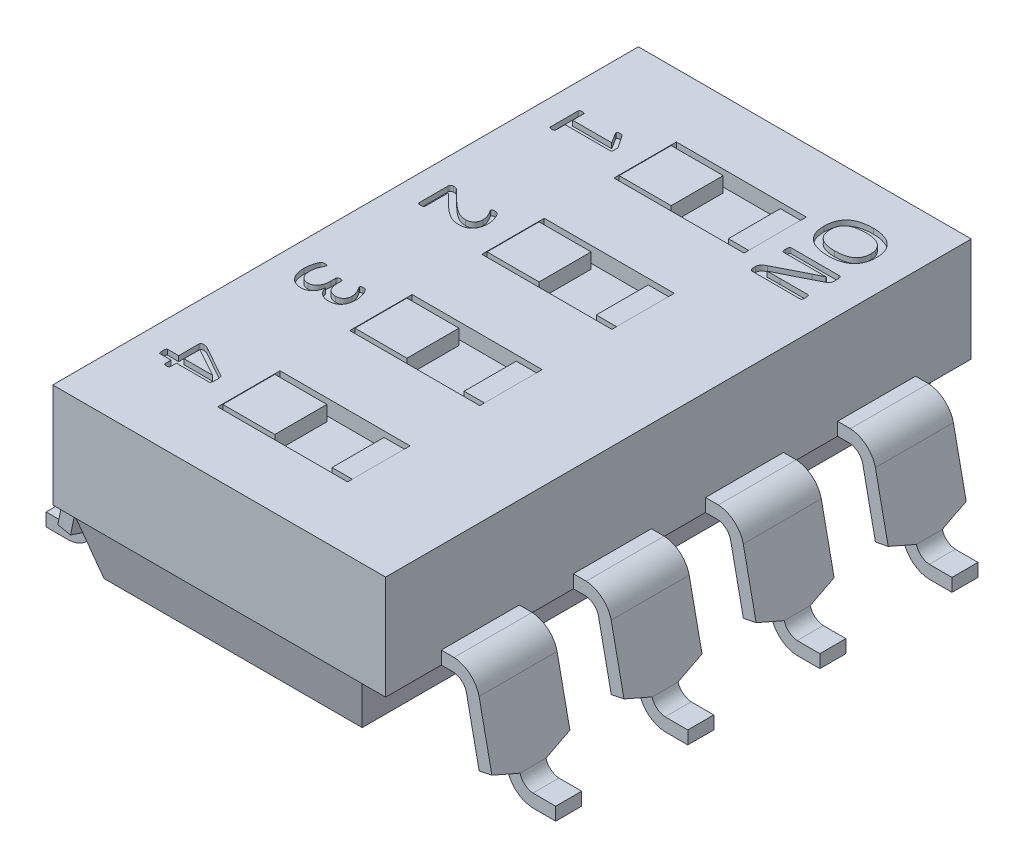
from build123d import *

# Parameters (mm, degrees)
SKETCH1_W                 = 6.4
SKETCH1_H                 = 2
BOSS_EXTRUDE1_DEPTH       = 11.26
SKETCH3_W                 = 5.5
SKETCH3_H                 = 11.26
BOSS_EXTRUDE2_DEPTH       = 1
BOSS_EXTRUDE2_TAPER       = 15
BOSS_EXTRUDE3_DEPTH       = 1.5
CUT_EXTRUDE1_DEPTH        = 14.463996838
SKETCH6_W                 = 1.075878149
SKETCH6_H                 = 0.544890631
SKETCH6_H_2               = 0.541853054
CUT_EXTRUDE2_DEPTH        = 14.633928031
LPATTERN1_COUNT           = 4
LPATTERN1_PITCH           = 2.54
MIRROR1_COPY_1_DEPTH      = 1.5
MIRROR1_COPY_2_DEPTH      = 1.5
MIRROR1_COPY_3_DEPTH      = 1.5
MIRROR1_COPY_4_DEPTH      = 14.463996838
MIRROR1_COPY_5_DEPTH      = 14.463996838
MIRROR1_COPY_6_DEPTH      = 14.463996838
MIRROR1_COPY_7_SKETCH_W   = 1.075878149
MIRROR1_COPY_7_SKETCH_H   = 0.544890631
MIRROR1_COPY_7_SKETCH_H_2 = 0.541853054
MIRROR1_COPY_7_DEPTH      = 14.633928031
MIRROR1_COPY_8_SKETCH_W   = 1.075878149
MIRROR1_COPY_8_SKETCH_H   = 0.544890631
MIRROR1_COPY_8_SKETCH_H_2 = 0.541853054
MIRROR1_COPY_8_DEPTH      = 14.633928031
MIRROR1_COPY_9_SKETCH_W   = 1.075878149
MIRROR1_COPY_9_SKETCH_H   = 0.544890631
MIRROR1_COPY_9_SKETCH_H_2 = 0.541853054
MIRROR1_COPY_9_DEPTH      = 14.633928031
SKETCH7_W                 = 2.5
SKETCH7_H                 = 1.2
CUT_EXTRUDE3_DEPTH        = 0.5
SKETCH8_W                 = 2.5
SKETCH8_H                 = 1.2
BOSS_EXTRUDE4_DEPTH       = 0.2
SKETCH9_W                 = 1
SKETCH9_H                 = 1
SKETCH9_W_2               = 0.4
BOSS_EXTRUDE5_DEPTH       = 0.29
LPATTERN2_COUNT           = 4
LPATTERN2_PITCH           = 2.54
CUT_EXTRUDE_1_DEPTH       = 0.1


with BuildPart() as part:
    # Sketch1 → Boss-Extrude1 (new body)
    with BuildSketch(Plane.XY):
        with Locations((3.2, 1)):
            Rectangle(SKETCH1_W, SKETCH1_H)
    extrude(amount=BOSS_EXTRUDE1_DEPTH)

    # Sketch3 → Boss-Extrude2 (add)
    with BuildSketch(Plane.XZ):
        with Locations((3.2, 5.63)):
            Rectangle(SKETCH3_W, SKETCH3_H)
    extrude(amount=BOSS_EXTRUDE2_DEPTH, taper=BOSS_EXTRUDE2_TAPER)

    # Sketch4 → Boss-Extrude3 (add)
    with BuildSketch(Plane.XY.offset(10.19)):
        with BuildLine():
            Line((0, 0.25), (-0.246171761, 0.25))
            ThreePointArc((-0.246171761, 0.25), (-0.554195762, 0.125012352), (-0.72701005, -0.158952292))
            Line((-0.72701005, -0.158952292), (-1.01402555, -1.543536682))
            ThreePointArc((-1.01402555, -1.543536682), (-1.106345513, -1.685456773), (-1.26286535, -1.75))
            Line((-1.26286535, -1.75), (-1.7, -1.75))
            Line((-1.7, -1.75), (-1.7, -2))
            Line((-1.7, -2), (-1.253405123, -2))
            ThreePointArc((-1.253405123, -2), (-0.947758808, -1.878721464), (-0.770747325, -1.601602197))
            Line((-0.770747325, -1.601602197), (-0.482890076, -0.212957144))
            ThreePointArc((-0.482890076, -0.212957144), (-0.393953766, -0.066905047), (-0.236586053, 0))
            Line((-0.236586053, 0), (0, 0))
            Line((0, 0), (0, 0.25))
        make_face()
    boss_extrude3 = extrude(amount=-BOSS_EXTRUDE3_DEPTH)

    # Sketch5 → Cut-Extrude1 (cut, through all)
    with BuildSketch(Plane(origin=(-0.665464806, 0.137946603, 0), x_dir=(0, 0, 1), z_dir=(-0.9791832101750784, 0.20297842474319372, 0))):
        Polygon((9.69, -1.717230512), (10.19, -1.517230512), (10.19, -1.717230512), align=None)
        Polygon((8.69, -1.717230512), (8.69, -1.517230512), (9.19, -1.717230512), align=None)
    cut_extrude1 = extrude(amount=-CUT_EXTRUDE1_DEPTH, mode=Mode.SUBTRACT)

    # Sketch6 → Cut-Extrude2 (cut, through all)
    with BuildSketch(Plane(origin=(-0.348560744, -1.681483286, 0), x_dir=(0.9791832101750784, -0.20297842474319375, 0), z_dir=(0.20297842474319375, 0.9791832101750784, 0))):
        with Locations((-0.967551224, -9.962445316)):
            Rectangle(SKETCH6_W, SKETCH6_H)
        with Locations((-0.967551224, -8.919073473)):
            Rectangle(SKETCH6_W, SKETCH6_H_2)
    cut_extrude2 = extrude(amount=-CUT_EXTRUDE2_DEPTH, mode=Mode.SUBTRACT)

    # LPattern1: Boss-Extrude3, Cut-Extrude1, Cut-Extrude2 ×4
    with Locations(*[(0, 0, -i * LPATTERN1_PITCH) for i in range(1, LPATTERN1_COUNT)]):
        add(boss_extrude3)
        add(cut_extrude1, mode=Mode.SUBTRACT)
        add(cut_extrude2, mode=Mode.SUBTRACT)

    # Mirror1: Boss-Extrude3, Cut-Extrude1, Cut-Extrude2 across plane
    add(boss_extrude3.mirror(Plane.ZY.offset(-3.2)))
    add(cut_extrude1.mirror(Plane.ZY.offset(-3.2)), mode=Mode.SUBTRACT)
    add(cut_extrude2.mirror(Plane.ZY.offset(-3.2)), mode=Mode.SUBTRACT)

    # Mirror1 copy 1 sketch → Mirror1 copy 1 (add)
    with BuildSketch(Plane(origin=(6.4, 0, 7.65), x_dir=(-1, 0, 0), z_dir=(0, 0, 1))):
        with BuildLine():
            Line((0, -0.25), (-0.246171761, -0.25))
            ThreePointArc((-0.246171761, -0.25), (-0.554195762, -0.125012352), (-0.72701005, 0.158952292))
            Line((-0.72701005, 0.158952292), (-1.01402555, 1.543536682))
            ThreePointArc((-1.01402555, 1.543536682), (-1.106345513, 1.685456773), (-1.26286535, 1.75))
            Line((-1.26286535, 1.75), (-1.7, 1.75))
            Line((-1.7, 1.75), (-1.7, 2))
            Line((-1.7, 2), (-1.253405123, 2))
            ThreePointArc((-1.253405123, 2), (-0.947758808, 1.878721464), (-0.770747325, 1.601602197))
            Line((-0.770747325, 1.601602197), (-0.482890076, 0.212957144))
            ThreePointArc((-0.482890076, 0.212957144), (-0.393953766, 0.066905047), (-0.236586053, 0))
            Line((-0.236586053, 0), (0, 0))
            Line((0, 0), (0, -0.25))
        make_face()
    extrude(amount=-MIRROR1_COPY_1_DEPTH)

    # Mirror1 copy 2 sketch → Mirror1 copy 2 (add)
    with BuildSketch(Plane(origin=(6.4, 0, 5.11), x_dir=(-1, 0, 0), z_dir=(0, 0, 1))):
        with BuildLine():
            Line((0, -0.25), (-0.246171761, -0.25))
            ThreePointArc((-0.246171761, -0.25), (-0.554195762, -0.125012352), (-0.72701005, 0.158952292))
            Line((-0.72701005, 0.158952292), (-1.01402555, 1.543536682))
            ThreePointArc((-1.01402555, 1.543536682), (-1.106345513, 1.685456773), (-1.26286535, 1.75))
            Line((-1.26286535, 1.75), (-1.7, 1.75))
            Line((-1.7, 1.75), (-1.7, 2))
            Line((-1.7, 2), (-1.253405123, 2))
            ThreePointArc((-1.253405123, 2), (-0.947758808, 1.878721464), (-0.770747325, 1.601602197))
            Line((-0.770747325, 1.601602197), (-0.482890076, 0.212957144))
            ThreePointArc((-0.482890076, 0.212957144), (-0.393953766, 0.066905047), (-0.236586053, 0))
            Line((-0.236586053, 0), (0, 0))
            Line((0, 0), (0, -0.25))
        make_face()
    extrude(amount=-MIRROR1_COPY_2_DEPTH)

    # Mirror1 copy 3 sketch → Mirror1 copy 3 (add)
    with BuildSketch(Plane(origin=(6.4, 0, 2.57), x_dir=(-1, 0, 0), z_dir=(0, 0, 1))):
        with BuildLine():
            Line((0, -0.25), (-0.246171761, -0.25))
            ThreePointArc((-0.246171761, -0.25), (-0.554195762, -0.125012352), (-0.72701005, 0.158952292))
            Line((-0.72701005, 0.158952292), (-1.01402555, 1.543536682))
            ThreePointArc((-1.01402555, 1.543536682), (-1.106345513, 1.685456773), (-1.26286535, 1.75))
            Line((-1.26286535, 1.75), (-1.7, 1.75))
            Line((-1.7, 1.75), (-1.7, 2))
            Line((-1.7, 2), (-1.253405123, 2))
            ThreePointArc((-1.253405123, 2), (-0.947758808, 1.878721464), (-0.770747325, 1.601602197))
            Line((-0.770747325, 1.601602197), (-0.482890076, 0.212957144))
            ThreePointArc((-0.482890076, 0.212957144), (-0.393953766, 0.066905047), (-0.236586053, 0))
            Line((-0.236586053, 0), (0, 0))
            Line((0, 0), (0, -0.25))
        make_face()
    extrude(amount=-MIRROR1_COPY_3_DEPTH)

    # Mirror1 copy 4 sketch → Mirror1 copy 4 (cut, through all)
    with BuildSketch(Plane(origin=(7.065464806, 0.137946603, -2.54), x_dir=(0, 0, 1), z_dir=(0.9791832101750784, 0.20297842474319372, 0))):
        Polygon((9.69, 1.717230512), (10.19, 1.517230512), (10.19, 1.717230512), align=None)
        Polygon((8.69, 1.717230512), (8.69, 1.517230512), (9.19, 1.717230512), align=None)
    extrude(amount=-MIRROR1_COPY_4_DEPTH, mode=Mode.SUBTRACT)

    # Mirror1 copy 5 sketch → Mirror1 copy 5 (cut, through all)
    with BuildSketch(Plane(origin=(7.065464806, 0.137946603, -5.08), x_dir=(0, 0, 1), z_dir=(0.9791832101750784, 0.20297842474319372, 0))):
        Polygon((9.69, 1.717230512), (10.19, 1.517230512), (10.19, 1.717230512), align=None)
        Polygon((8.69, 1.717230512), (8.69, 1.517230512), (9.19, 1.717230512), align=None)
    extrude(amount=-MIRROR1_COPY_5_DEPTH, mode=Mode.SUBTRACT)

    # Mirror1 copy 6 sketch → Mirror1 copy 6 (cut, through all)
    with BuildSketch(Plane(origin=(7.065464806, 0.137946603, -7.62), x_dir=(0, 0, 1), z_dir=(0.9791832101750784, 0.20297842474319372, 0))):
        Polygon((9.69, 1.717230512), (10.19, 1.517230512), (10.19, 1.717230512), align=None)
        Polygon((8.69, 1.717230512), (8.69, 1.517230512), (9.19, 1.717230512), align=None)
    extrude(amount=-MIRROR1_COPY_6_DEPTH, mode=Mode.SUBTRACT)

    # Mirror1 copy 7 sketch → Mirror1 copy 7 (cut, through all)
    with BuildSketch(Plane(origin=(6.748560744, -1.681483286, -2.54), x_dir=(-0.9791832101750784, -0.20297842474319375, 0), z_dir=(-0.20297842474319375, 0.9791832101750784, 0))):
        with Locations((-0.967551224, 9.962445316)):
            Rectangle(MIRROR1_COPY_7_SKETCH_W, MIRROR1_COPY_7_SKETCH_H)
        with Locations((-0.967551224, 8.919073473)):
            Rectangle(MIRROR1_COPY_7_SKETCH_W, MIRROR1_COPY_7_SKETCH_H_2)
    extrude(amount=-MIRROR1_COPY_7_DEPTH, mode=Mode.SUBTRACT)

    # Mirror1 copy 8 sketch → Mirror1 copy 8 (cut, through all)
    with BuildSketch(Plane(origin=(6.748560744, -1.681483286, -5.08), x_dir=(-0.9791832101750784, -0.20297842474319375, 0), z_dir=(-0.20297842474319375, 0.9791832101750784, 0))):
        with Locations((-0.967551224, 9.962445316)):
            Rectangle(MIRROR1_COPY_8_SKETCH_W, MIRROR1_COPY_8_SKETCH_H)
        with Locations((-0.967551224, 8.919073473)):
            Rectangle(MIRROR1_COPY_8_SKETCH_W, MIRROR1_COPY_8_SKETCH_H_2)
    extrude(amount=-MIRROR1_COPY_8_DEPTH, mode=Mode.SUBTRACT)

    # Mirror1 copy 9 sketch → Mirror1 copy 9 (cut, through all)
    with BuildSketch(Plane(origin=(6.748560744, -1.681483286, -7.62), x_dir=(-0.9791832101750784, -0.20297842474319375, 0), z_dir=(-0.20297842474319375, 0.9791832101750784, 0))):
        with Locations((-0.967551224, 9.962445316)):
            Rectangle(MIRROR1_COPY_9_SKETCH_W, MIRROR1_COPY_9_SKETCH_H)
        with Locations((-0.967551224, 8.919073473)):
            Rectangle(MIRROR1_COPY_9_SKETCH_W, MIRROR1_COPY_9_SKETCH_H_2)
    extrude(amount=-MIRROR1_COPY_9_DEPTH, mode=Mode.SUBTRACT)

    # Sketch7 → Cut-Extrude3 (cut)
    with BuildSketch(Plane(origin=(0, 2, 0), x_dir=(1, 0, 0), z_dir=(0, 1, 0))):
        with Locations((3.2, -4.36)):
            Rectangle(SKETCH7_W, SKETCH7_H)
        with Locations((3.2, -1.82)):
            Rectangle(SKETCH7_W, SKETCH7_H)
        with Locations((3.2, -6.9)):
            Rectangle(SKETCH7_W, SKETCH7_H)
        with Locations((3.2, -9.44)):
            Rectangle(SKETCH7_W, SKETCH7_H)
    extrude(amount=-CUT_EXTRUDE3_DEPTH, mode=Mode.SUBTRACT)

    # Sketch8 → Boss-Extrude4 (add)
    with BuildSketch(Plane(origin=(0, 1.5, 0), x_dir=(1, 0, 0), z_dir=(0, 1, 0))):
        with Locations((3.2, -1.82)):
            Rectangle(SKETCH8_W, SKETCH8_H)
    boss_extrude4 = extrude(amount=BOSS_EXTRUDE4_DEPTH)

    # Sketch9 → Boss-Extrude5 (add)
    with BuildSketch(Plane(origin=(0, 1.7, 0), x_dir=(1, 0, 0), z_dir=(0, 1, 0))):
        with Locations((2.45, -1.82)):
            Rectangle(SKETCH9_W, SKETCH9_H)
        with Locations((4.25, -1.82)):
            Rectangle(SKETCH9_W_2, SKETCH9_H)
    boss_extrude5 = extrude(amount=BOSS_EXTRUDE5_DEPTH)

    # LPattern2: Boss-Extrude4, Boss-Extrude5 ×4
    with Locations(*[(0, 0, i * LPATTERN2_PITCH) for i in range(1, LPATTERN2_COUNT)]):
        add(boss_extrude4)
        add(boss_extrude5)

    # Sketch10 → Вырез-Вытянуть1 (cut)
    # profile 1 of 6: a face of its own
    with BuildSketch(Plane(origin=(0, 2, 0), x_dir=(1, 0, 0), z_dir=(0, 1, 0))):
        with BuildLine():
            add(Edge.make_bspline(
                [(5.296111026, -1.658169902), (5.276415082, -1.65780976), (5.237869423, -1.657104948), (5.181572343, -1.651818383), (5.128175235, -1.642908135), (5.077914447, -1.630325924), (5.030822162, -1.61438402), (4.987412598, -1.594564993), (4.947619433, -1.5712187), (4.911264448, -1.544588722), (4.878874772, -1.514014249), (4.850437961, -1.479859672), (4.826212439, -1.441937152), (4.805597463, -1.400677098), (4.789494429, -1.355554195), (4.778158021, -1.306836801), (4.771123985, -1.254575775), (4.770326816, -1.218548393), (4.769916173, -1.199989755)],
                knots=[0, 0, 0, 0, 1.191349841, 2.33151377, 3.416966321, 4.463182302, 5.462485, 6.420369482, 7.344547342, 8.24900213, 9.140535385, 10.032176993, 10.930546801, 11.856778172, 12.816733517, 13.821446026, 14.877770412, 16, 16, 16, 16], degree=3))
            add(Edge.make_bspline(
                [(4.769916173, -1.199989755), (4.77025943, -1.181738427), (4.770925173, -1.146340132), (4.777563717, -1.095296376), (4.787668937, -1.04794648), (4.80240302, -1.004444924), (4.821437516, -0.964706156), (4.84385202, -0.928293187), (4.870656264, -0.895906407), (4.900970806, -0.866884179), (4.935291276, -0.8415093), (4.973376217, -0.81961191), (5.015398876, -0.801521457), (5.06106516, -0.786547071), (5.110557836, -0.775266333), (5.163613879, -0.767076203), (5.220181522, -0.761907945), (5.259105033, -0.761381574), (5.27910735, -0.761111079)],
                knots=[0, 0, 0, 0, 1.137667702, 2.206496874, 3.204370452, 4.15299996, 5.06318426, 5.947235594, 6.812662801, 7.677575739, 8.558407935, 9.46786496, 10.411212271, 11.406659154, 12.461056006, 13.573073946, 14.752832389, 16, 16, 16, 16], degree=3))
            add(Edge.make_bspline(
                [(5.27910735, -0.761111079), (5.298421286, -0.761465208), (5.336128163, -0.762156579), (5.391344906, -0.76751966), (5.44383741, -0.776353053), (5.493530309, -0.789040053), (5.540212384, -0.804841193), (5.583314893, -0.824763248), (5.62277562, -0.848219346), (5.658624933, -0.875246858), (5.690861439, -0.905707392), (5.719069533, -0.93999897), (5.743317796, -0.9779736), (5.7635412, -1.019536972), (5.779735038, -1.064565806), (5.791135402, -1.113279288), (5.798101069, -1.165550401), (5.798911396, -1.201652397), (5.799327938, -1.220210343)],
                knots=[0, 0, 0, 0, 1.175343485, 2.294640089, 3.372947809, 4.412007972, 5.413017894, 6.368293769, 7.296489874, 8.201798854, 9.095401933, 9.989527717, 10.897317773, 11.831337077, 12.797167058, 13.803492583, 14.870902707, 16, 16, 16, 16], degree=3))
            add(Edge.make_bspline(
                [(5.799327938, -1.220210343), (5.798947315, -1.238073742), (5.798208119, -1.272765685), (5.792039602, -1.323045387), (5.781419467, -1.369731096), (5.767042018, -1.412926795), (5.74857092, -1.452585905), (5.726082152, -1.488734289), (5.699852065, -1.521601601), (5.669437808, -1.550708613), (5.635339459, -1.576308392), (5.597700277, -1.598808906), (5.556036865, -1.617296774), (5.510787266, -1.632451034), (5.461942971, -1.644090834), (5.409684611, -1.65215143), (5.35404565, -1.657393295), (5.315808017, -1.657905866), (5.296111026, -1.658169902)],
                knots=[0, 0, 0, 0, 1.124153723, 2.183183562, 3.18197749, 4.133311137, 5.04347791, 5.929104716, 6.80702139, 7.683308329, 8.57135945, 9.485819096, 10.43743367, 11.434504052, 12.485735786, 13.593802196, 14.76051808, 16, 16, 16, 16], degree=3))
        make_face()
        with BuildLine():
            add(Edge.make_bspline(
                [(5.286230512, -1.511111079), (5.300021735, -1.510938698), (5.327172843, -1.510599327), (5.367130944, -1.507801633), (5.40562373, -1.50319098), (5.442529843, -1.496976483), (5.477494537, -1.488259734), (5.510310372, -1.477298636), (5.540752463, -1.463756745), (5.56879887, -1.447628613), (5.594216822, -1.428786426), (5.616787665, -1.406994883), (5.636141518, -1.38218005), (5.652674757, -1.354549989), (5.665881183, -1.323685601), (5.67520297, -1.28944835), (5.680737313, -1.25179385), (5.681357642, -1.225591575), (5.681680879, -1.211938284)],
                knots=[0, 0, 0, 0, 1.16906547, 2.301566814, 3.393680675, 4.454778471, 5.47212095, 6.44540886, 7.384232912, 8.291912384, 9.18278391, 10.059847445, 10.943138162, 11.842909913, 12.782474672, 13.779662713, 14.843042763, 16, 16, 16, 16], degree=3))
            add(Edge.make_bspline(
                [(5.681680879, -1.211938284), (5.681299923, -1.198281423), (5.680568264, -1.172052283), (5.674554753, -1.134365787), (5.664533655, -1.100096878), (5.650345542, -1.069154747), (5.632654162, -1.041551867), (5.612526734, -1.016371337), (5.589524171, -0.994052302), (5.563737363, -0.974730082), (5.535742015, -0.957811964), (5.505381389, -0.943622797), (5.472728943, -0.932093727), (5.4380546, -0.923367592), (5.401907379, -0.916486743), (5.364604579, -0.911782413), (5.326420155, -0.908618046), (5.300636546, -0.908320327), (5.287609188, -0.908169902)],
                knots=[0, 0, 0, 0, 1.161227874, 2.230234876, 3.23623063, 4.189578402, 5.115044591, 6.018624442, 6.926329179, 7.833285333, 8.754014825, 9.704195839, 10.678922322, 11.695036858, 12.742866953, 13.807197742, 14.89207049, 16, 16, 16, 16], degree=3))
            add(Edge.make_bspline(
                [(5.287609188, -0.908169902), (5.273357585, -0.908333329), (5.245363122, -0.90865435), (5.20427868, -0.911560182), (5.164826613, -0.915753289), (5.127279824, -0.922121394), (5.091777988, -0.930584673), (5.058542725, -0.941133119), (5.028050266, -0.954942072), (4.999885098, -0.970681929), (4.974282243, -0.989021901), (4.952023076, -1.010768097), (4.932570134, -1.035278306), (4.916153576, -1.062804892), (4.903036029, -1.093664398), (4.894092359, -1.128111288), (4.888479127, -1.166181633), (4.88787745, -1.192768618), (4.887563232, -1.206653358)],
                knots=[0, 0, 0, 0, 1.197112985, 2.35149234, 3.458580793, 4.529125571, 5.548253836, 6.522942298, 7.453293408, 8.355171445, 9.230372149, 10.090421365, 10.960688115, 11.852339373, 12.774981647, 13.767684789, 14.834199703, 16, 16, 16, 16], degree=3))
            add(Edge.make_bspline(
                [(4.887563232, -1.206653358), (4.887948083, -1.220386382), (4.888689487, -1.246842686), (4.894691548, -1.284907231), (4.904709141, -1.319634972), (4.918874034, -1.350958873), (4.936475201, -1.379010661), (4.957226174, -1.403891525), (4.98020336, -1.426526914), (5.006435664, -1.445778393), (5.035097031, -1.462319514), (5.065878953, -1.476332534), (5.09886274, -1.487579954), (5.133688002, -1.496441999), (5.170180307, -1.503037394), (5.207949042, -1.50744946), (5.246729737, -1.510677032), (5.272973006, -1.510965401), (5.286230512, -1.511111079)],
                knots=[0, 0, 0, 0, 1.156376524, 2.227728346, 3.236314579, 4.192133592, 5.114055089, 6.016996904, 6.915872434, 7.824329852, 8.74947427, 9.699417313, 10.668622314, 11.681101484, 12.723901887, 13.789878023, 14.883496378, 16, 16, 16, 16], degree=3))
        make_face(mode=Mode.SUBTRACT)
    # profile 2 of 6: a face of its own
    with BuildSketch(Plane(origin=(0, 2, 0), x_dir=(1, 0, 0), z_dir=(0, 1, 0))):
        with BuildLine():
            add(Edge.make_bspline(
                [(4.84160735, -2.64346402), (4.836819423, -2.643249752), (4.827801797, -2.642846198), (4.815438866, -2.638514108), (4.805405261, -2.631971473), (4.797427081, -2.623724859), (4.791385344, -2.614156891), (4.787291694, -2.603526683), (4.785016497, -2.592398156), (4.784751813, -2.58487963), (4.784622056, -2.581193799)],
                knots=[0, 0, 0, 0, 1.205195523, 2.269876715, 3.262688849, 4.206796125, 5.146133144, 6.101866096, 7.069471963, 8, 8, 8, 8], degree=3))
            Line((4.784622056, -2.581193799), (4.784622056, -2.534318799))
            add(Edge.make_bspline(
                [(4.784622056, -2.534318799), (4.784838811, -2.527338145), (4.78524404, -2.514287613), (4.788349687, -2.495580775), (4.794758579, -2.478686343), (4.804784274, -2.462877466), (4.8188187, -2.447825424), (4.836834074, -2.43274342), (4.85961408, -2.417801409), (4.876899641, -2.408844867), (4.886184556, -2.404033873)],
                knots=[0, 0, 0, 0, 0.949295484, 1.774735033, 2.565947931, 3.389611136, 4.303976894, 5.353577399, 6.578477978, 8, 8, 8, 8], degree=3))
            Line((4.886184556, -2.404033873), (5.452361026, -2.114511814))
            add(Edge.make_bspline(
                [(5.452361026, -2.114511814), (5.467355327, -2.106893188), (5.497863432, -2.091391976), (5.544256333, -2.06866389), (5.590997595, -2.046537914), (5.622368827, -2.032646771), (5.637793012, -2.025816961)],
                knots=[0, 0, 0, 0, 0.981709107, 1.997431203, 3.015403985, 4, 4, 4, 4], degree=3))
            Line((5.637793012, -2.025816961), (5.637793012, -2.024208505))
            add(Edge.make_bspline(
                [(5.637793012, -2.024208505), (5.619181721, -2.024642749), (5.581503023, -2.025521878), (5.524665347, -2.025896817), (5.467373335, -2.025797057), (5.429153324, -2.025810335), (5.410081615, -2.025816961)],
                knots=[0, 0, 0, 0, 0.98097619, 1.98599371, 2.995014897, 4, 4, 4, 4], degree=3))
            Line((5.410081615, -2.025816961), (4.809208453, -2.025816961))
            add(Edge.make_bspline(
                [(4.809208453, -2.025816961), (4.8074249, -2.02560895), (4.80376218, -2.025181778), (4.798376834, -2.022522689), (4.793909418, -2.017266681), (4.790455866, -2.009579989), (4.78866988, -1.999248972), (4.785992034, -1.986483665), (4.784854783, -1.970302916), (4.784705021, -1.958414099), (4.784622056, -1.95182799)],
                knots=[0, 0, 0, 0, 0.507629026, 1.042471493, 1.658265389, 2.426739807, 3.40789359, 4.62344465, 6.12947268, 8, 8, 8, 8], degree=3))
            add(Edge.make_bspline(
                [(4.784622056, -1.95182799), (4.784701778, -1.945240891), (4.784845687, -1.933350284), (4.786018089, -1.917180279), (4.788554384, -1.904604654), (4.790546702, -1.8946416), (4.793873694, -1.887234585), (4.798521446, -1.882332685), (4.803692199, -1.879338601), (4.807413644, -1.878947001), (4.809208453, -1.878758137)],
                knots=[0, 0, 0, 0, 1.891572084, 3.414544002, 4.643770878, 5.571751689, 6.329019298, 6.93561505, 7.486659786, 8, 8, 8, 8], degree=3))
            Line((4.809208453, -1.878758137), (5.727636762, -1.878758137))
            add(Edge.make_bspline(
                [(5.727636762, -1.878758137), (5.732406701, -1.878954637), (5.741400615, -1.879325145), (5.753925471, -1.882695298), (5.764245041, -1.88880036), (5.771840066, -1.897398466), (5.777431315, -1.907052889), (5.781687993, -1.917152028), (5.784008619, -1.927828751), (5.784414607, -1.935043847), (5.784622056, -1.938730564)],
                knots=[0, 0, 0, 0, 1.222480005, 2.305035548, 3.292617378, 4.252430297, 5.213047754, 6.147369849, 7.053356642, 8, 8, 8, 8], degree=3))
            Line((5.784622056, -1.938730564), (5.784622056, -2.008813284))
            add(Edge.make_bspline(
                [(5.784622056, -2.008813284), (5.784500215, -2.016407484), (5.784276277, -2.030365193), (5.781360452, -2.04963887), (5.776187551, -2.066182331), (5.768213218, -2.08069719), (5.757065417, -2.093974925), (5.742854345, -2.106672613), (5.724768771, -2.118920354), (5.711094347, -2.126214002), (5.703739703, -2.130136814)],
                knots=[0, 0, 0, 0, 1.163684759, 2.138786855, 2.978191552, 3.808674946, 4.659829269, 5.624477827, 6.722350489, 8, 8, 8, 8], degree=3))
            Line((5.703739703, -2.130136814), (5.266929041, -2.352333505))
            add(Edge.make_bspline(
                [(5.266929041, -2.352333505), (5.253749233, -2.358985509), (5.227695407, -2.372135181), (5.189173753, -2.391829856), (5.151129341, -2.41033374), (5.113927296, -2.428531387), (5.077281265, -2.446230287), (5.041152651, -2.463741465), (5.005209309, -2.481092318), (4.981170654, -2.492368078), (4.969134923, -2.498013652)],
                knots=[0, 0, 0, 0, 1.068742979, 2.112689677, 3.13185519, 4.131205534, 5.110747879, 6.077892953, 7.037634914, 8, 8, 8, 8], degree=3))
            add(Edge.make_bspline(
                [(4.969134923, -2.498013652), (4.989737889, -2.498279915), (5.031783849, -2.497416516), (5.095283211, -2.496869507), (5.158778575, -2.496294428), (5.200829029, -2.49636877), (5.221432717, -2.496405196)],
                knots=[0, 0, 0, 0, 0.980070645, 2.000100891, 3.020098614, 4, 4, 4, 4], degree=3))
            Line((5.221432717, -2.496405196), (5.760035659, -2.496405196))
            add(Edge.make_bspline(
                [(5.760035659, -2.496405196), (5.761834631, -2.496583895), (5.765497425, -2.496947734), (5.770601647, -2.500062178), (5.775135263, -2.505186114), (5.77863792, -2.512853128), (5.781677205, -2.522866769), (5.783238163, -2.535890704), (5.784406376, -2.552294607), (5.784544705, -2.564492451), (5.784622056, -2.571313284)],
                knots=[0, 0, 0, 0, 0.502953326, 1.024036879, 1.634158783, 2.404945848, 3.372755644, 4.570153255, 6.082086269, 8, 8, 8, 8], degree=3))
            add(Edge.make_bspline(
                [(5.784622056, -2.571313284), (5.784536795, -2.577444882), (5.784377828, -2.588877192), (5.783181617, -2.604584207), (5.781762323, -2.617650327), (5.778506628, -2.627598363), (5.774765373, -2.63496908), (5.770447284, -2.640093271), (5.765267914, -2.642831746), (5.761745441, -2.643257407), (5.760035659, -2.64346402)],
                knots=[0, 0, 0, 0, 1.781386541, 3.321379914, 4.580616967, 5.587268504, 6.344121305, 6.974526363, 7.50224285, 8, 8, 8, 8], degree=3))
            Line((5.760035659, -2.64346402), (4.84160735, -2.64346402))
        make_face()
    # profile 3 of 6: a face of its own
    with BuildSketch(Plane(origin=(0, 2, 0), x_dir=(1, 0, 0), z_dir=(0, 1, 0))):
        with BuildLine():
            add(Edge.make_bspline(
                [(0.539031739, -2.207070391), (0.534666938, -2.206904836), (0.526668423, -2.206601457), (0.515584664, -2.205286138), (0.506836255, -2.202081994), (0.499674121, -2.198815442), (0.494422857, -2.194465336), (0.490534239, -2.189692273), (0.488757265, -2.184204103), (0.488416652, -2.180576968), (0.488250489, -2.178807523)],
                knots=[0, 0, 0, 0, 1.626914997, 2.981328552, 4.126067624, 5.082084556, 5.892289713, 6.644788339, 7.338879749, 8, 8, 8, 8], degree=3))
            Line((0.488250489, -2.178807523), (0.488250489, -1.647097964))
            add(Edge.make_bspline(
                [(0.488250489, -1.647097964), (0.488400353, -1.645324401), (0.488695412, -1.64183253), (0.490606522, -1.636598608), (0.494553854, -1.632097586), (0.499691735, -1.627586065), (0.506659872, -1.623647547), (0.51568227, -1.621044555), (0.526624049, -1.619164105), (0.534655537, -1.618951138), (0.539031739, -1.618835096)],
                knots=[0, 0, 0, 0, 0.664049556, 1.307411016, 2.040676551, 2.872895705, 3.860084643, 5.000950549, 6.365876435, 8, 8, 8, 8], degree=3))
            add(Edge.make_bspline(
                [(0.539031739, -1.618835096), (0.543180581, -1.618851698), (0.550914215, -1.618882643), (0.56157171, -1.620922566), (0.570585204, -1.623261277), (0.577909266, -1.62658394), (0.583836391, -1.630325735), (0.587895613, -1.635200438), (0.590623695, -1.640558158), (0.591002782, -1.644463007), (0.591191665, -1.646408626)],
                knots=[0, 0, 0, 0, 1.529937288, 2.851873351, 3.999151653, 4.962201758, 5.818165368, 6.561341605, 7.283178177, 8, 8, 8, 8], degree=3))
            Line((0.591191665, -1.646408626), (0.591191665, -1.854129214))
            Line((0.591191665, -1.854129214), (1.341191665, -1.854129214))
            Line((1.341191665, -1.854129214), (1.223544607, -1.665020758))
            add(Edge.make_bspline(
                [(1.223544607, -1.665020758), (1.221405138, -1.660695715), (1.217731686, -1.65326965), (1.213734861, -1.643037288), (1.21364391, -1.63431412), (1.217593285, -1.627245559), (1.225226503, -1.622673117), (1.235803536, -1.620218409), (1.249482334, -1.619055628), (1.259694533, -1.618913826), (1.265364459, -1.618835096)],
                knots=[0, 0, 0, 0, 1.299809481, 2.231762388, 2.932755888, 3.56928973, 4.312341354, 5.252235573, 6.474410853, 8, 8, 8, 8], degree=3))
            add(Edge.make_bspline(
                [(1.265364459, -1.618835096), (1.269580709, -1.61884073), (1.277335998, -1.618851092), (1.288064497, -1.61986661), (1.297037685, -1.621044315), (1.304443054, -1.623187564), (1.310659915, -1.625920671), (1.315937489, -1.629872209), (1.32087661, -1.634834737), (1.323781831, -1.638781413), (1.325336886, -1.64089392)],
                knots=[0, 0, 0, 0, 1.503679701, 2.765839883, 3.844451719, 4.726829847, 5.509588363, 6.253183833, 7.064995274, 8, 8, 8, 8], degree=3))
            Line((1.325336886, -1.64089392), (1.478599754, -1.866537302))
            add(Edge.make_bspline(
                [(1.478599754, -1.866537302), (1.479415618, -1.867814395), (1.481161067, -1.870546589), (1.482872968, -1.875514094), (1.484506565, -1.881430692), (1.486088388, -1.888551769), (1.487624746, -1.896961767), (1.487723439, -1.906908925), (1.488431331, -1.918688398), (1.488314912, -1.927273605), (1.488250489, -1.932024435)],
                knots=[0, 0, 0, 0, 0.541270067, 1.157985617, 1.870459843, 2.742627338, 3.771300412, 4.925232739, 6.298504129, 8, 8, 8, 8], degree=3))
            add(Edge.make_bspline(
                [(1.488250489, -1.932024435), (1.488172165, -1.938385286), (1.488029518, -1.949969989), (1.486828111, -1.965601755), (1.48543701, -1.978112551), (1.483034711, -1.987587268), (1.479914076, -1.994482941), (1.475852924, -1.9987535), (1.471253958, -2.000746608), (1.468198887, -2.001039607), (1.466651224, -2.001188038)],
                knots=[0, 0, 0, 0, 1.93989485, 3.533034417, 4.782157296, 5.774019735, 6.505473852, 7.067217241, 7.527463125, 8, 8, 8, 8], degree=3))
            Line((1.466651224, -2.001188038), (0.591191665, -2.001188038))
            Line((0.591191665, -2.001188038), (0.591191665, -2.179726641))
            add(Edge.make_bspline(
                [(0.591191665, -2.179726641), (0.590983527, -2.181665098), (0.590550849, -2.185694761), (0.587968749, -2.191329492), (0.583907936, -2.196482212), (0.577951418, -2.20027017), (0.570552638, -2.203287216), (0.561581912, -2.205512461), (0.550867423, -2.206860213), (0.543172292, -2.206996863), (0.539031739, -2.207070391)],
                knots=[0, 0, 0, 0, 0.7127164, 1.481593899, 2.242181371, 3.093242657, 4.039538559, 5.172928216, 6.478825056, 8, 8, 8, 8], degree=3))
        make_face()
    # profile 4 of 6: a face of its own
    with BuildSketch(Plane(origin=(0, 2, 0), x_dir=(1, 0, 0), z_dir=(0, 1, 0))):
        with BuildLine():
            add(Edge.make_bspline(
                [(0.547993136, -4.732364508), (0.54339694, -4.732273661), (0.534717107, -4.732102096), (0.522499755, -4.730920933), (0.512190508, -4.728226028), (0.503426633, -4.725477295), (0.496476349, -4.721364702), (0.491691494, -4.715836224), (0.488785682, -4.709491823), (0.488428336, -4.704972284), (0.488250489, -4.702722964)],
                knots=[0, 0, 0, 0, 1.489906125, 2.813661235, 3.963352874, 4.936648299, 5.783738147, 6.540177947, 7.273464357, 8, 8, 8, 8], degree=3))
            Line((0.488250489, -4.702722964), (0.488250489, -4.144588773))
            add(Edge.make_bspline(
                [(0.488250489, -4.144588773), (0.488361415, -4.141130089), (0.48856839, -4.134676588), (0.490647948, -4.125590409), (0.494369578, -4.117711993), (0.500171928, -4.110997993), (0.508291481, -4.10546676), (0.519319418, -4.102342281), (0.532822653, -4.100289001), (0.54277331, -4.100109741), (0.548222915, -4.100011567)],
                knots=[0, 0, 0, 0, 0.957296837, 1.786204342, 2.564657155, 3.347438747, 4.218745545, 5.245748887, 6.491598905, 8, 8, 8, 8], degree=3))
            add(Edge.make_bspline(
                [(0.548222915, -4.100011567), (0.55320485, -4.100026303), (0.56248934, -4.100053765), (0.575604419, -4.1010066), (0.587240511, -4.102487802), (0.59736726, -4.106284439), (0.606838534, -4.110723602), (0.616061438, -4.116391658), (0.625844714, -4.123152078), (0.632004406, -4.128728933), (0.635309312, -4.131721126)],
                knots=[0, 0, 0, 0, 1.248300695, 2.326372208, 3.29870174, 4.173199784, 5.023541064, 5.919285072, 6.883618024, 8, 8, 8, 8], degree=3))
            Line((0.635309312, -4.131721126), (0.837515195, -4.330020758))
            add(Edge.make_bspline(
                [(0.837515195, -4.330020758), (0.848925567, -4.341057895), (0.870824955, -4.362240949), (0.903626597, -4.391416865), (0.93430023, -4.417476363), (0.963418025, -4.440189011), (0.991094525, -4.459785113), (1.01745278, -4.476846337), (1.042319164, -4.491864113), (1.066214519, -4.504374875), (1.088912638, -4.51476072), (1.110580651, -4.523044992), (1.13104873, -4.529584699), (1.156434662, -4.535574475), (1.18655318, -4.539900831), (1.210280645, -4.540769661), (1.221706371, -4.541188038)],
                knots=[0, 0, 0, 0, 1.481993424, 2.844319856, 4.097794907, 5.23927794, 6.29087123, 7.262782702, 8.170318147, 9.001963922, 9.779621996, 10.499431107, 11.166628186, 11.784107905, 12.932959022, 14, 14, 14, 14], degree=3))
            add(Edge.make_bspline(
                [(1.221706371, -4.541188038), (1.23248268, -4.540668482), (1.253826135, -4.539639454), (1.284663244, -4.531108492), (1.31278337, -4.517395654), (1.333358027, -4.501620183), (1.347531957, -4.486528611), (1.357034598, -4.473781426), (1.365501706, -4.459730813), (1.372532376, -4.444380651), (1.378314723, -4.427785435), (1.382516055, -4.409934577), (1.384672808, -4.390888521), (1.38509427, -4.377819469), (1.385309312, -4.371151273)],
                knots=[0, 0, 0, 0, 1.461325649, 2.894287857, 4.308216251, 5.687370908, 6.386334382, 7.114327838, 7.842024094, 8.609787993, 9.402435548, 10.22481765, 11.094252324, 12, 12, 12, 12], degree=3))
            add(Edge.make_bspline(
                [(1.385309312, -4.371151273), (1.385119732, -4.363255555), (1.384748777, -4.347805925), (1.382238741, -4.325271936), (1.377940916, -4.303931869), (1.369552611, -4.27795266), (1.357899919, -4.24832777), (1.342076676, -4.216882468), (1.326819643, -4.190020744), (1.313656616, -4.171399279), (1.30515656, -4.158536151), (1.300633303, -4.150743459), (1.297845057, -4.144000199), (1.297309468, -4.139780279), (1.297074018, -4.13792517)],
                knots=[0, 0, 0, 0, 1.12185447, 2.195143914, 3.217564088, 4.208986583, 6.070366348, 7.734985986, 9.207813202, 10.45449472, 10.973722813, 11.397624206, 11.735190899, 12, 12, 12, 12], degree=3))
            add(Edge.make_bspline(
                [(1.297074018, -4.13792517), (1.297266245, -4.136060562), (1.297635132, -4.132482344), (1.300129392, -4.127452602), (1.304627992, -4.123408185), (1.31107488, -4.120282936), (1.31953698, -4.117815258), (1.330256271, -4.116071166), (1.343314389, -4.114983606), (1.352831344, -4.114810719), (1.357965562, -4.114717449)],
                knots=[0, 0, 0, 0, 0.626994726, 1.203214339, 1.841232839, 2.624976246, 3.595012486, 4.798194362, 6.272686196, 8, 8, 8, 8], degree=3))
            add(Edge.make_bspline(
                [(1.357965562, -4.114717449), (1.361722435, -4.114737143), (1.36863056, -4.114773356), (1.378185339, -4.115626498), (1.38642928, -4.116212047), (1.393387725, -4.11835194), (1.39984767, -4.12024342), (1.405971502, -4.123530307), (1.412799034, -4.128526789), (1.418477035, -4.1351122), (1.424413973, -4.142001682), (1.429518965, -4.149482903), (1.435861099, -4.158326239), (1.445049256, -4.173587572), (1.457611916, -4.196195218), (1.470961635, -4.22821921), (1.483483554, -4.264792909), (1.493952528, -4.305042474), (1.501895721, -4.348179128), (1.502598276, -4.37800682), (1.502956371, -4.393210096)],
                knots=[0, 0, 0, 0, 0.59161797, 1.087865329, 1.513111827, 1.887906468, 2.231462331, 2.571608127, 2.977211751, 3.557891302, 3.935011475, 4.410719616, 4.983312722, 5.649973301, 7.216457069, 9.055106146, 11.108863513, 13.304782751, 15.606831757, 18, 18, 18, 18], degree=3))
            add(Edge.make_bspline(
                [(1.502956371, -4.393210096), (1.502659729, -4.405166381), (1.502082115, -4.428447331), (1.498541132, -4.462233963), (1.492076805, -4.49368668), (1.483154881, -4.522788985), (1.471806083, -4.549364022), (1.458963149, -4.573945944), (1.44375185, -4.595853751), (1.426992307, -4.615700917), (1.408119953, -4.632529134), (1.388379695, -4.64789751), (1.36658357, -4.660059543), (1.343818193, -4.670526626), (1.319879298, -4.67862794), (1.294956169, -4.683955784), (1.269378721, -4.68762348), (1.252050325, -4.688037785), (1.243305636, -4.688246861)],
                knots=[0, 0, 0, 0, 1.29465352, 2.520913946, 3.672407435, 4.766225656, 5.810509321, 6.797367928, 7.763485313, 8.692663561, 9.60250791, 10.496491861, 11.395500496, 12.297335129, 13.20733064, 14.124815023, 15.053697165, 16, 16, 16, 16], degree=3))
            add(Edge.make_bspline(
                [(1.243305636, -4.688246861), (1.227432284, -4.687848584), (1.195632057, -4.687050686), (1.155861921, -4.681631875), (1.123666556, -4.674509532), (1.098560986, -4.666216084), (1.072445093, -4.655930162), (1.045225935, -4.643129836), (1.016948809, -4.627401687), (0.987252992, -4.608562204), (0.955760369, -4.587065857), (0.922742119, -4.561941638), (0.887573726, -4.533281255), (0.850255668, -4.500307546), (0.810172368, -4.463318914), (0.7831347, -4.436717833), (0.76904093, -4.422851641)],
                knots=[0, 0, 0, 0, 1.191016361, 2.386048717, 3.005183205, 3.663253618, 4.367762878, 5.110914589, 5.918807533, 6.794395923, 7.749457028, 8.77955308, 9.907152425, 11.153586631, 12.516266528, 14, 14, 14, 14], degree=3))
            Line((0.76904093, -4.422851641), (0.605897548, -4.261776273))
            Line((0.605897548, -4.261776273), (0.605897548, -4.701803846))
            add(Edge.make_bspline(
                [(0.605897548, -4.701803846), (0.605699847, -4.70389406), (0.605288134, -4.708246936), (0.602483638, -4.714490226), (0.597520364, -4.719901946), (0.59113048, -4.724740747), (0.582804597, -4.728414053), (0.572782679, -4.730858681), (0.560970441, -4.732131855), (0.552515052, -4.732283441), (0.547993136, -4.732364508)],
                knots=[0, 0, 0, 0, 0.691935757, 1.440958077, 2.213630646, 3.100900409, 4.076485527, 5.20166228, 6.50345759, 8, 8, 8, 8], degree=3))
        make_face()
    # profile 5 of 6: a face of its own
    with BuildSketch(Plane(origin=(0, 2, 0), x_dir=(1, 0, 0), z_dir=(0, 1, 0))):
        with BuildLine():
            add(Edge.make_bspline(
                [(0.771338724, -7.257658626), (0.760219573, -7.257322888), (0.738506529, -7.256667272), (0.706741921, -7.252324014), (0.676706767, -7.244697276), (0.648376046, -7.234093196), (0.621792758, -7.220797686), (0.597332745, -7.204502009), (0.574599097, -7.185876347), (0.554153815, -7.16431804), (0.535573223, -7.140322233), (0.519579843, -7.113439631), (0.505498984, -7.084173344), (0.493790738, -7.052330816), (0.484596002, -7.018038811), (0.47835637, -6.981492711), (0.474319854, -6.942874222), (0.473807595, -6.916446804), (0.473544607, -6.902879214)],
                knots=[0, 0, 0, 0, 1.02051527, 1.992822477, 2.935687511, 3.858848873, 4.764281464, 5.65726605, 6.551052721, 7.455966652, 8.378351471, 9.330785808, 10.321221483, 11.355469781, 12.440004905, 13.574950084, 14.755001966, 16, 16, 16, 16], degree=3))
            add(Edge.make_bspline(
                [(0.473544607, -6.902879214), (0.473827936, -6.886466143), (0.474375308, -6.854757259), (0.480500615, -6.809262737), (0.48863691, -6.76793166), (0.498423405, -6.731258821), (0.509122064, -6.699982626), (0.518401015, -6.677619917), (0.526122133, -6.663389328), (0.530295666, -6.65512664), (0.533942484, -6.649020534), (0.537866684, -6.643940807), (0.542056765, -6.639380472), (0.547518404, -6.63547245), (0.553422171, -6.632438861), (0.560309553, -6.629938336), (0.568377824, -6.627464411), (0.578302346, -6.62633967), (0.590173194, -6.625311817), (0.598846988, -6.625307856), (0.603599754, -6.625305685)],
                knots=[0, 0, 0, 0, 2.600624991, 5.024221999, 7.265335753, 9.277317192, 11.036223664, 12.504840978, 13.107774136, 13.602109818, 13.97284915, 14.23274147, 14.619255648, 14.949607363, 15.291800234, 15.668459141, 16.110506343, 16.62573138, 17.246975895, 18, 18, 18, 18], degree=3))
            add(Edge.make_bspline(
                [(0.603599754, -6.625305685), (0.607667138, -6.625284248), (0.615132345, -6.625244902), (0.625226481, -6.626545251), (0.633483355, -6.627846545), (0.641052579, -6.631073109), (0.648493077, -6.636657843), (0.649521667, -6.643271898), (0.650015195, -6.646445391)],
                knots=[0, 0, 0, 0, 1.294648135, 2.376175188, 3.247907822, 3.937397471, 5.010341939, 6, 6, 6, 6], degree=3))
            add(Edge.make_bspline(
                [(0.650015195, -6.646445391), (0.649840979, -6.647914426), (0.649405988, -6.651582378), (0.646778431, -6.657661216), (0.643103853, -6.665538778), (0.635789483, -6.67904925), (0.625266765, -6.699803232), (0.612289776, -6.729236403), (0.599184589, -6.764432458), (0.589352063, -6.79736835), (0.582471307, -6.826410788), (0.579309572, -6.850119185), (0.576770419, -6.874945142), (0.57658196, -6.891919059), (0.576485783, -6.90058142)],
                knots=[0, 0, 0, 0, 0.198391755, 0.495353168, 0.882914201, 1.37192777, 2.561965477, 4.016553971, 5.700532455, 7.616059291, 8.641916137, 9.71545352, 10.834119071, 12, 12, 12, 12], degree=3))
            add(Edge.make_bspline(
                [(0.576485783, -6.90058142), (0.576694956, -6.908934188), (0.577100676, -6.925135499), (0.579297225, -6.948748636), (0.583445746, -6.970804753), (0.589156533, -6.991353842), (0.596439977, -7.010239926), (0.605438692, -7.027377189), (0.615047977, -7.043399269), (0.626741093, -7.057382248), (0.639392259, -7.069918462), (0.653250789, -7.080701503), (0.668120939, -7.090076012), (0.684175413, -7.097620728), (0.701253763, -7.103306196), (0.719022365, -7.107444559), (0.737485505, -7.110041082), (0.750037365, -7.110411795), (0.756403062, -7.110599802)],
                knots=[0, 0, 0, 0, 1.282977079, 2.488505694, 3.63738486, 4.724765536, 5.760134096, 6.738616936, 7.694931779, 8.622680294, 9.529309996, 10.425811154, 11.313549863, 12.22383473, 13.142591769, 14.07272333, 15.022578229, 16, 16, 16, 16], degree=3))
            add(Edge.make_bspline(
                [(0.756403062, -7.110599802), (0.763381503, -7.110345505), (0.77701983, -7.109848518), (0.796962727, -7.10694526), (0.815742096, -7.101531243), (0.833529223, -7.094221721), (0.850206125, -7.084626911), (0.865833945, -7.073279106), (0.879916186, -7.059600236), (0.893176514, -7.044483474), (0.90480413, -7.027110223), (0.915230572, -7.008003757), (0.923863097, -6.986914588), (0.931299411, -6.96413043), (0.936811947, -6.939559027), (0.941439957, -6.913449241), (0.943479874, -6.885601118), (0.943911352, -6.866499134), (0.944132842, -6.856693552)],
                knots=[0, 0, 0, 0, 0.943173963, 1.843293744, 2.714696557, 3.577639248, 4.435103673, 5.308593387, 6.179688881, 7.08218522, 8.02080606, 8.997890629, 10.01845557, 11.095192955, 12.232352564, 13.418198318, 14.674689118, 16, 16, 16, 16], degree=3))
            Line((0.944132842, -6.856693552), (0.944132842, -6.760415979))
            add(Edge.make_bspline(
                [(0.944132842, -6.760415979), (0.944292334, -6.758340176), (0.944611535, -6.754185758), (0.946392745, -6.74797054), (0.950196187, -6.742502658), (0.955551887, -6.737597828), (0.962821752, -6.733918599), (0.971907212, -6.73045323), (0.983659175, -6.728541239), (0.992381109, -6.72835179), (0.997211886, -6.728246861)],
                knots=[0, 0, 0, 0, 0.718033544, 1.437039375, 2.199431173, 2.985286651, 3.919769982, 4.990151192, 6.332948787, 8, 8, 8, 8], degree=3))
            add(Edge.make_bspline(
                [(0.997211886, -6.728246861), (1.00159363, -6.728252086), (1.009562389, -6.728261588), (1.020373764, -6.730306869), (1.029310943, -6.732670899), (1.035851621, -6.7369662), (1.041334647, -6.741156676), (1.044425957, -6.746785113), (1.046772848, -6.752722321), (1.046970572, -6.757019079), (1.047074018, -6.759267082)],
                knots=[0, 0, 0, 0, 1.584021297, 2.880744349, 3.987480851, 4.897224109, 5.704547135, 6.452351486, 7.190291968, 8, 8, 8, 8], degree=3))
            Line((1.047074018, -6.759267082), (1.047074018, -6.847042817))
            add(Edge.make_bspline(
                [(1.047074018, -6.847042817), (1.047259113, -6.855321774), (1.047621615, -6.87153586), (1.050199066, -6.89519107), (1.054248733, -6.917667785), (1.060217718, -6.938733982), (1.067755994, -6.958395324), (1.077067161, -6.976408396), (1.087597536, -6.993008439), (1.099592165, -7.00813862), (1.113236995, -7.021385802), (1.127920428, -7.033239109), (1.14406321, -7.043149151), (1.161230363, -7.051687964), (1.179703607, -7.058448001), (1.19934345, -7.062820438), (1.219914397, -7.066075903), (1.234024058, -7.066344722), (1.241237621, -7.066482155)],
                knots=[0, 0, 0, 0, 1.201335114, 2.352778556, 3.449423679, 4.512136322, 5.525692348, 6.500090447, 7.449829245, 8.37511959, 9.294784203, 10.204452164, 11.108192112, 12.037812337, 12.983705363, 13.954355396, 14.954164324, 16, 16, 16, 16], degree=3))
            add(Edge.make_bspline(
                [(1.241237621, -7.066482155), (1.251701832, -7.066006871), (1.272452246, -7.065064387), (1.302491838, -7.057216249), (1.33014821, -7.04487537), (1.350279384, -7.029922369), (1.363981506, -7.015576665), (1.373348116, -7.003344465), (1.380941096, -6.989392176), (1.388013032, -6.974461738), (1.393479869, -6.958118248), (1.397379011, -6.940487503), (1.399683598, -6.92170638), (1.399903168, -6.90878336), (1.400015195, -6.902189876)],
                knots=[0, 0, 0, 0, 1.457634464, 2.890473119, 4.300671371, 5.659557412, 6.354692491, 7.064047808, 7.800788575, 8.565575956, 9.366232007, 10.198204909, 11.080702011, 12, 12, 12, 12], degree=3))
            add(Edge.make_bspline(
                [(1.400015195, -6.902189876), (1.39982545, -6.894829743), (1.399452729, -6.880372069), (1.396908212, -6.859141083), (1.392615229, -6.838798416), (1.384219918, -6.813664013), (1.372385874, -6.784670767), (1.356857052, -6.753389872), (1.341366901, -6.726730727), (1.32883758, -6.70776181), (1.319841692, -6.695388586), (1.315423165, -6.687800552), (1.312645023, -6.681621173), (1.312032165, -6.677863461), (1.311779901, -6.676316714)],
                knots=[0, 0, 0, 0, 1.075919207, 2.113452191, 3.121563001, 4.109572389, 5.983117876, 7.695791947, 9.211136911, 10.487585107, 11.018742244, 11.445140838, 11.771609294, 12, 12, 12, 12], degree=3))
            add(Edge.make_bspline(
                [(1.311779901, -6.676316714), (1.311865137, -6.674625967), (1.312027253, -6.67141024), (1.313384965, -6.666649897), (1.316604268, -6.662639453), (1.321546794, -6.659203504), (1.328679759, -6.657200217), (1.337978343, -6.655557062), (1.350066255, -6.65476979), (1.359114852, -6.654736209), (1.364169607, -6.654717449)],
                knots=[0, 0, 0, 0, 0.637454196, 1.21240982, 1.829959373, 2.534428886, 3.446941913, 4.590317458, 6.095272496, 8, 8, 8, 8], degree=3))
            add(Edge.make_bspline(
                [(1.364169607, -6.654717449), (1.367694683, -6.654753636), (1.374369331, -6.654822154), (1.383801241, -6.655535173), (1.392066433, -6.656529187), (1.399236402, -6.658436979), (1.405454623, -6.660981771), (1.411380787, -6.664218262), (1.417704873, -6.66848619), (1.423028177, -6.67385291), (1.428124793, -6.679811702), (1.432833845, -6.686454129), (1.438301326, -6.695039601), (1.44737831, -6.709455779), (1.459245169, -6.731241091), (1.472416122, -6.761819255), (1.484662236, -6.797529195), (1.49455435, -6.838158233), (1.50181715, -6.883099186), (1.502568706, -6.914490414), (1.502956371, -6.930682523)],
                knots=[0, 0, 0, 0, 0.563728971, 1.067407315, 1.512716173, 1.893123123, 2.250329652, 2.584746433, 2.972191313, 3.466088563, 3.787691153, 4.226377318, 4.766720565, 5.416080958, 6.951262542, 8.728997125, 10.736021437, 12.982533632, 15.411908805, 18, 18, 18, 18], degree=3))
            add(Edge.make_bspline(
                [(1.502956371, -6.930682523), (1.502720252, -6.94202441), (1.502261378, -6.964066263), (1.499162222, -6.996146396), (1.493371747, -7.026021612), (1.485598719, -7.053802035), (1.475719666, -7.07933457), (1.463991292, -7.102813033), (1.450173332, -7.123940207), (1.434649125, -7.142994833), (1.417481758, -7.159871297), (1.398282571, -7.174121729), (1.377915955, -7.186727528), (1.355669896, -7.196538798), (1.332144444, -7.204058319), (1.307402691, -7.209654959), (1.281379205, -7.212841194), (1.263611258, -7.213304891), (1.254564827, -7.213540979)],
                knots=[0, 0, 0, 0, 1.274946817, 2.477735093, 3.617490519, 4.69131085, 5.716178017, 6.690318443, 7.635963854, 8.547646244, 9.448738015, 10.333810944, 11.230077501, 12.135723274, 13.058718295, 14.002833947, 14.983156323, 16, 16, 16, 16], degree=3))
            add(Edge.make_bspline(
                [(1.254564827, -7.213540979), (1.246742255, -7.213465584), (1.23135995, -7.213317329), (1.208765435, -7.210447179), (1.186871583, -7.207067819), (1.165967986, -7.201492592), (1.146125072, -7.194275383), (1.127288598, -7.185909208), (1.109702149, -7.175829551), (1.093040037, -7.164725042), (1.077873593, -7.151606557), (1.063638892, -7.137488154), (1.050602142, -7.121897425), (1.038942051, -7.10488623), (1.028472636, -7.086535091), (1.020123141, -7.066646536), (1.012965731, -7.045582915), (1.009992632, -7.030832505), (1.008471077, -7.023283626)],
                knots=[0, 0, 0, 0, 1.103181861, 2.169296688, 3.210790191, 4.228215415, 5.216505366, 6.189059868, 7.133075319, 8.074611407, 9.010357587, 9.958264882, 10.902280332, 11.87387298, 12.866175589, 13.878302888, 14.914170303, 16, 16, 16, 16], degree=3))
            Line((1.008471077, -7.023283626), (1.006862621, -7.023283626))
            add(Edge.make_bspline(
                [(1.006862621, -7.023283626), (1.005759905, -7.031804728), (1.003600271, -7.048493035), (0.998304667, -7.072902831), (0.990922792, -7.096101235), (0.981761525, -7.118165817), (0.970921841, -7.138752042), (0.958977182, -7.158101598), (0.945321173, -7.175713991), (0.930656522, -7.192081598), (0.914784123, -7.206936434), (0.897382283, -7.219853962), (0.878721176, -7.231075535), (0.858972582, -7.240837409), (0.838158855, -7.248364719), (0.816509464, -7.253665054), (0.794188171, -7.256965071), (0.77900934, -7.257425798), (0.771338724, -7.257658626)],
                knots=[0, 0, 0, 0, 1.128189899, 2.209523898, 3.275351225, 4.321580856, 5.342995186, 6.328300667, 7.30416285, 8.26576514, 9.212518813, 10.15412763, 11.106476666, 12.069288486, 13.043074364, 14.006831714, 14.992753268, 16, 16, 16, 16], degree=3))
        make_face()
    # profile 6 of 6: a face of its own
    with BuildSketch(Plane(origin=(0, 2, 0), x_dir=(1, 0, 0), z_dir=(0, 1, 0))):
        with BuildLine():
            add(Edge.make_bspline(
                [(0.775015195, -9.852116346), (0.767861928, -9.851859848), (0.754940215, -9.851396509), (0.739901693, -9.846691232), (0.731373031, -9.840517419), (0.726781071, -9.835423855), (0.724062616, -9.82929715), (0.723721221, -9.824952308), (0.723544607, -9.822704582)],
                knots=[0, 0, 0, 0, 1.955005781, 3.531536633, 4.205992547, 4.814817639, 5.386867129, 6, 6, 6, 6], degree=3))
            Line((0.723544607, -9.822704582), (0.723544607, -9.709423332))
            Line((0.723544607, -9.709423332), (0.512377327, -9.709423332))
            add(Edge.make_bspline(
                [(0.512377327, -9.709423332), (0.510439746, -9.709240131), (0.506687907, -9.708885389), (0.501209392, -9.706158249), (0.497451742, -9.700472205), (0.493850569, -9.692976815), (0.491716571, -9.682670697), (0.489428935, -9.669688198), (0.488553849, -9.65328762), (0.488358144, -9.641177083), (0.488250489, -9.634515244)],
                knots=[0, 0, 0, 0, 0.545274321, 1.055843022, 1.65463473, 2.415779468, 3.392573903, 4.592865474, 6.125782412, 8, 8, 8, 8], degree=3))
            add(Edge.make_bspline(
                [(0.488250489, -9.634515244), (0.488353022, -9.628081462), (0.488539976, -9.616350432), (0.489483919, -9.600351421), (0.491625059, -9.587626356), (0.493943682, -9.577637435), (0.497252932, -9.570354668), (0.501460833, -9.565402364), (0.506647974, -9.562602658), (0.510429566, -9.56244547), (0.512377327, -9.562364508)],
                knots=[0, 0, 0, 0, 1.861135843, 3.393500298, 4.627958667, 5.589640473, 6.35245344, 6.917172441, 7.442274693, 8, 8, 8, 8], degree=3))
            Line((0.512377327, -9.562364508), (0.723544607, -9.562364508))
            Line((0.723544607, -9.562364508), (0.723544607, -9.169671494))
            add(Edge.make_bspline(
                [(0.723544607, -9.169671494), (0.723595256, -9.16698343), (0.723687604, -9.162082343), (0.725302358, -9.15508972), (0.728697652, -9.149185052), (0.733773506, -9.143770237), (0.741359174, -9.13968119), (0.751602854, -9.137315918), (0.764566965, -9.136102847), (0.774246135, -9.135968423), (0.779610783, -9.13589392)],
                knots=[0, 0, 0, 0, 0.851245106, 1.552056553, 2.247801827, 2.986300217, 3.877804907, 4.932032463, 6.299588955, 8, 8, 8, 8], degree=3))
            add(Edge.make_bspline(
                [(0.779610783, -9.13589392), (0.783976484, -9.135960571), (0.792250741, -9.136086893), (0.804146206, -9.136422485), (0.814905815, -9.137539689), (0.824740925, -9.139398117), (0.833817169, -9.141932958), (0.842516459, -9.145306254), (0.851427139, -9.149268722), (0.857370919, -9.152401088), (0.860493136, -9.154046494)],
                knots=[0, 0, 0, 0, 1.246623122, 2.362708354, 3.396266899, 4.331202275, 5.217296842, 6.082365681, 6.992682945, 8, 8, 8, 8], degree=3))
            Line((0.860493136, -9.154046494), (1.46435343, -9.493200905))
            add(Edge.make_bspline(
                [(1.46435343, -9.493200905), (1.466355337, -9.494800864), (1.47064238, -9.498227142), (1.47563138, -9.505651508), (1.479730365, -9.515090439), (1.483095453, -9.526758817), (1.485953738, -9.541030454), (1.487247338, -9.558285417), (1.488222085, -9.578742878), (1.488240512, -9.593459245), (1.488250489, -9.601427008)],
                knots=[0, 0, 0, 0, 0.536074483, 1.147992565, 1.854085549, 2.694401517, 3.695171134, 4.907733342, 6.325779029, 8, 8, 8, 8], degree=3))
            add(Edge.make_bspline(
                [(1.488250489, -9.601427008), (1.488213433, -9.610087114), (1.488144164, -9.626275709), (1.486361123, -9.648635402), (1.48452043, -9.667317013), (1.481797901, -9.68221869), (1.478549538, -9.693933141), (1.474073601, -9.702374784), (1.46839222, -9.708423202), (1.463612397, -9.709103603), (1.461366298, -9.709423332)],
                knots=[0, 0, 0, 0, 1.766841745, 3.302810384, 4.576901922, 5.594869916, 6.395991728, 7.039811218, 7.548795215, 8, 8, 8, 8], degree=3))
            Line((1.461366298, -9.709423332), (0.826485783, -9.709423332))
            Line((0.826485783, -9.709423332), (0.826485783, -9.822704582))
            add(Edge.make_bspline(
                [(0.826485783, -9.822704582), (0.826393226, -9.82480298), (0.826207612, -9.829011118), (0.823426781, -9.83481319), (0.819424547, -9.840063043), (0.813735462, -9.844466282), (0.806372342, -9.847928553), (0.797347058, -9.850313527), (0.786717068, -9.851970004), (0.779082169, -9.852065485), (0.775015195, -9.852116346)],
                knots=[0, 0, 0, 0, 0.756138938, 1.516365143, 2.290226514, 3.142233621, 4.100785817, 5.228658292, 6.523755516, 8, 8, 8, 8], degree=3))
        make_face()
        Polygon((1.373131004, -9.562364508), (1.373131004, -9.560985832), (0.826485783, -9.257677008), (0.826485783, -9.562364508), align=None, mode=Mode.SUBTRACT)
    extrude(amount=-CUT_EXTRUDE_1_DEPTH, mode=Mode.SUBTRACT)


solid = part.part
